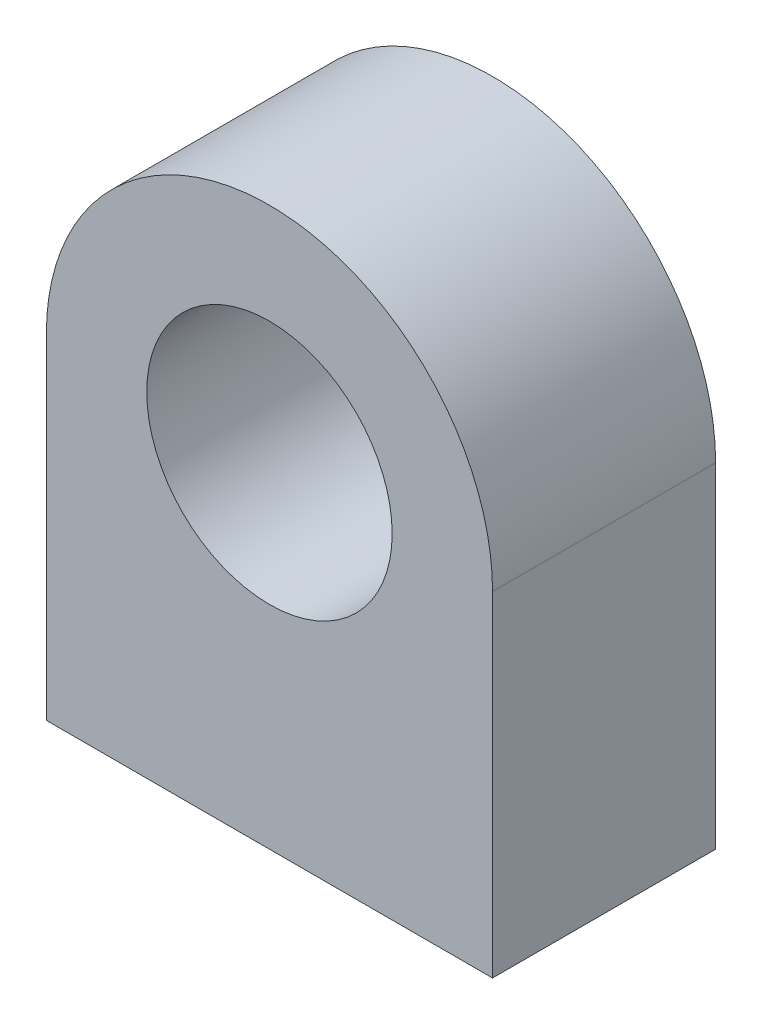
from build123d import *

# Parameters (mm, degrees)
SKETCH1_R           = 5.5
BOSS_EXTRUDE1_DEPTH = 10


with BuildPart() as part:
    # Sketch1 → Boss-Extrude1 (new body)
    with BuildSketch(Plane.XY):
        with BuildLine():
            Line((-10, 0), (-10, -15))
            Line((-10, -15), (10, -15))
            Line((10, -15), (10, 0))
            ThreePointArc((10, 0), (0, 10), (-10, 0))
        make_face()
        Circle(SKETCH1_R, mode=Mode.SUBTRACT)
    extrude(amount=BOSS_EXTRUDE1_DEPTH)


solid = part.part
